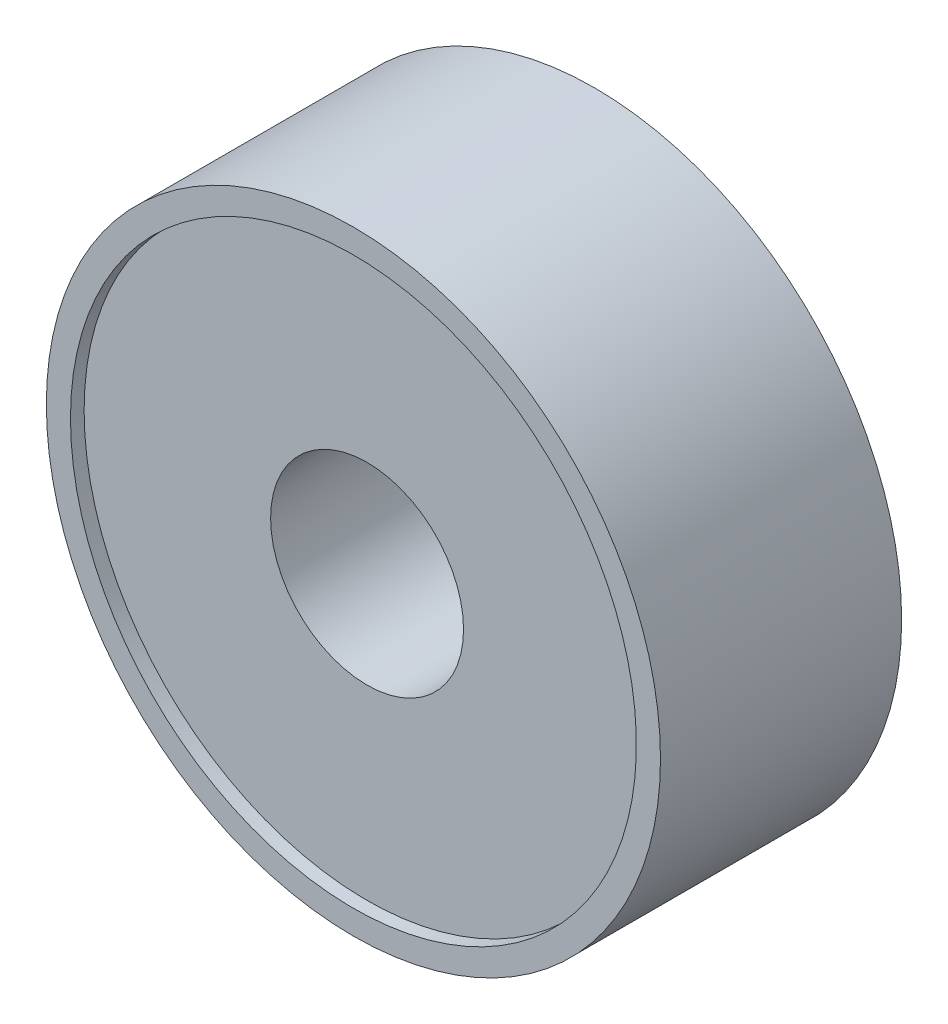
from build123d import *


with BuildPart() as part:
    # Sketch1 → Revolve4 (revolve)
    with BuildSketch(Plane(origin=(0, 0, 0), x_dir=(0, 0, -1), z_dir=(1, 0, 0)), mode=Mode.PRIVATE) as revolve4_sk:
        Polygon((-19.05, -48.514), (-19.05, -44.704), (-16.894738531, -44.704), (-16.894738531, -15.24), (16.894738531, -15.24), (16.894738531, -44.704), (19.05, -44.704), (19.05, -48.514), align=None)
    revolve(revolve4_sk.sketch.rotate(Axis((0, 0, 0), (0, 0, 1)), 270), axis=Axis((0, 0, 0), (0, 0, 1)))


solid = part.part
